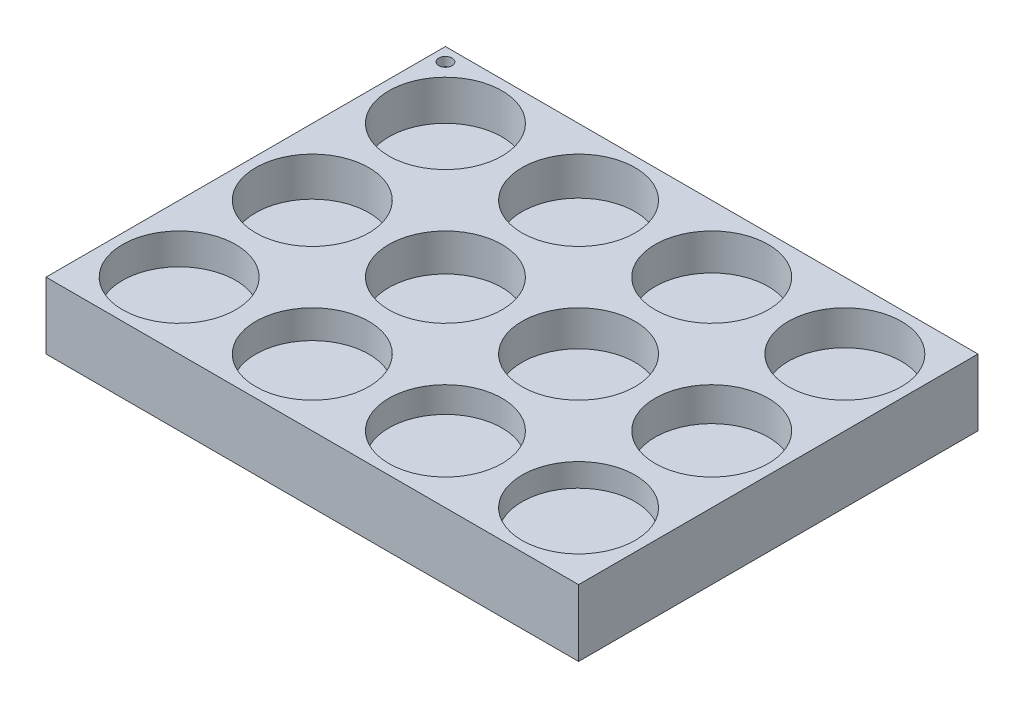
from build123d import *

# Parameters (mm, degrees)
SKETCH1_W           = 120
SKETCH1_H           = 90
SKETCH1_R           = 6.65
BOSS_EXTRUDE1_DEPTH = 5
SKETCH3_W           = 120
SKETCH3_H           = 90
BOSS_EXTRUDE6_DEPTH = 10
SKETCH2_R           = 12.75
CUT_EXTRUDE1_DEPTH  = 9
SKETCH2_8_R         = 12.75
CUT_EXTRUDE2_DEPTH  = 8.8
SKETCH2_9_R         = 12.75
CUT_EXTRUDE3_DEPTH  = 7
SKETCH2_10_R        = 12.75
CUT_EXTRUDE4_DEPTH  = 8.6
SKETCH2_11_R        = 12.75
CUT_EXTRUDE5_DEPTH  = 8.4
SKETCH2_12_R        = 12.75
CUT_EXTRUDE6_DEPTH  = 6.4
SKETCH2_13_R        = 12.75
CUT_EXTRUDE7_DEPTH  = 8.2
SKETCH2_14_R        = 12.75
CUT_EXTRUDE8_DEPTH  = 8
SKETCH2_15_R        = 12.75
CUT_EXTRUDE9_DEPTH  = 5.8
SKETCH2_16_R        = 12.75
CUT_EXTRUDE10_DEPTH = 7.8
SKETCH2_17_R        = 12.75
CUT_EXTRUDE11_DEPTH = 7.6
SKETCH2_18_R        = 12.75
CUT_EXTRUDE12_DEPTH = 5.2
SKETCH4_R           = 1.5
CUT_EXTRUDE13_DEPTH = 2


with BuildPart() as part:
    # Sketch1 → Boss-Extrude1 (new body)
    with BuildSketch(Plane(origin=(0, 0, 0), x_dir=(1, 0, 0), z_dir=(0, 1, 0))):
        Rectangle(SKETCH1_W, SKETCH1_H)
        with Locations(Location((-45, 30, 0), (0, 0, 270))):
            Circle(SKETCH1_R, mode=Mode.SUBTRACT)
        with Locations(Location((-15, 30, 0), (0, 0, 270))):
            Circle(SKETCH1_R, mode=Mode.SUBTRACT)
        with Locations(Location((15, 30, 0), (0, 0, 270))):
            Circle(SKETCH1_R, mode=Mode.SUBTRACT)
        with Locations(Location((45, 30, 0), (0, 0, 270))):
            Circle(SKETCH1_R, mode=Mode.SUBTRACT)
        with Locations(Location((-45, 0, 0), (0, 0, 270))):
            Circle(SKETCH1_R, mode=Mode.SUBTRACT)
        with Locations(Location((-15, 0, 0), (0, 0, 270))):
            Circle(SKETCH1_R, mode=Mode.SUBTRACT)
        with Locations(Location((15, 0, 0), (0, 0, 270))):
            Circle(SKETCH1_R, mode=Mode.SUBTRACT)
        with Locations(Location((45, 0, 0), (0, 0, 270))):
            Circle(SKETCH1_R, mode=Mode.SUBTRACT)
        with Locations(Location((-45, -30, 0), (0, 0, 270))):
            Circle(SKETCH1_R, mode=Mode.SUBTRACT)
        with Locations(Location((-15, -30, 0), (0, 0, 270))):
            Circle(SKETCH1_R, mode=Mode.SUBTRACT)
        with Locations(Location((15, -30, 0), (0, 0, 270))):
            Circle(SKETCH1_R, mode=Mode.SUBTRACT)
        with Locations(Location((45, -30, 0), (0, 0, 270))):
            Circle(SKETCH1_R, mode=Mode.SUBTRACT)
    extrude(amount=BOSS_EXTRUDE1_DEPTH)

    # Sketch3 → Boss-Extrude6 (add)
    with BuildSketch(Plane(origin=(0, 5, 0), x_dir=(1, 0, 0), z_dir=(0, 1, 0))):
        Rectangle(SKETCH3_W, SKETCH3_H)
    extrude(amount=BOSS_EXTRUDE6_DEPTH)

    # Sketch2 → Cut-Extrude1 (cut)
    with BuildSketch(Plane(origin=(0, 15, 0), x_dir=(1, 0, 0), z_dir=(0, 1, 0))):
        with Locations(Location((-45, 30, 0), (0, 0, 270))):
            Circle(SKETCH2_R)
    extrude(amount=-CUT_EXTRUDE1_DEPTH, mode=Mode.SUBTRACT)

    # Sketch2<8> → Cut-Extrude2 (cut)
    with BuildSketch(Plane(origin=(0, 15, 0), x_dir=(1, 0, 0), z_dir=(0, 1, 0))):
        with Locations(Location((-45, 0, 0), (0, 0, 270))):
            Circle(SKETCH2_8_R)
    extrude(amount=-CUT_EXTRUDE2_DEPTH, mode=Mode.SUBTRACT)

    # Sketch2<9> → Cut-Extrude3 (cut)
    with BuildSketch(Plane(origin=(0, 15, 0), x_dir=(1, 0, 0), z_dir=(0, 1, 0))):
        with Locations(Location((-45, -30, 0), (0, 0, 270))):
            Circle(SKETCH2_9_R)
    extrude(amount=-CUT_EXTRUDE3_DEPTH, mode=Mode.SUBTRACT)

    # Sketch2<10> → Cut-Extrude4 (cut)
    with BuildSketch(Plane(origin=(0, 15, 0), x_dir=(1, 0, 0), z_dir=(0, 1, 0))):
        with Locations(Location((-15, 30, 0), (0, 0, 270))):
            Circle(SKETCH2_10_R)
    extrude(amount=-CUT_EXTRUDE4_DEPTH, mode=Mode.SUBTRACT)

    # Sketch2<11> → Cut-Extrude5 (cut)
    with BuildSketch(Plane(origin=(0, 15, 0), x_dir=(1, 0, 0), z_dir=(0, 1, 0))):
        with Locations(Location((-15, 0, 0), (0, 0, 270))):
            Circle(SKETCH2_11_R)
    extrude(amount=-CUT_EXTRUDE5_DEPTH, mode=Mode.SUBTRACT)

    # Sketch2<12> → Cut-Extrude6 (cut)
    with BuildSketch(Plane(origin=(0, 15, 0), x_dir=(1, 0, 0), z_dir=(0, 1, 0))):
        with Locations(Location((-15, -30, 0), (0, 0, 270))):
            Circle(SKETCH2_12_R)
    extrude(amount=-CUT_EXTRUDE6_DEPTH, mode=Mode.SUBTRACT)

    # Sketch2<13> → Cut-Extrude7 (cut)
    with BuildSketch(Plane(origin=(0, 15, 0), x_dir=(1, 0, 0), z_dir=(0, 1, 0))):
        with Locations(Location((15, 30, 0), (0, 0, 270))):
            Circle(SKETCH2_13_R)
    extrude(amount=-CUT_EXTRUDE7_DEPTH, mode=Mode.SUBTRACT)

    # Sketch2<14> → Cut-Extrude8 (cut)
    with BuildSketch(Plane(origin=(0, 15, 0), x_dir=(1, 0, 0), z_dir=(0, 1, 0))):
        with Locations(Location((15, 0, 0), (0, 0, 270))):
            Circle(SKETCH2_14_R)
    extrude(amount=-CUT_EXTRUDE8_DEPTH, mode=Mode.SUBTRACT)

    # Sketch2<15> → Cut-Extrude9 (cut)
    with BuildSketch(Plane(origin=(0, 15, 0), x_dir=(1, 0, 0), z_dir=(0, 1, 0))):
        with Locations(Location((15, -30, 0), (0, 0, 270))):
            Circle(SKETCH2_15_R)
    extrude(amount=-CUT_EXTRUDE9_DEPTH, mode=Mode.SUBTRACT)

    # Sketch2<16> → Cut-Extrude10 (cut)
    with BuildSketch(Plane(origin=(0, 15, 0), x_dir=(1, 0, 0), z_dir=(0, 1, 0))):
        with Locations(Location((45, 30, 0), (0, 0, 270))):
            Circle(SKETCH2_16_R)
    extrude(amount=-CUT_EXTRUDE10_DEPTH, mode=Mode.SUBTRACT)

    # Sketch2<17> → Cut-Extrude11 (cut)
    with BuildSketch(Plane(origin=(0, 15, 0), x_dir=(1, 0, 0), z_dir=(0, 1, 0))):
        with Locations(Location((45, 0, 0), (0, 0, 270))):
            Circle(SKETCH2_17_R)
    extrude(amount=-CUT_EXTRUDE11_DEPTH, mode=Mode.SUBTRACT)

    # Sketch2<18> → Cut-Extrude12 (cut)
    with BuildSketch(Plane(origin=(0, 15, 0), x_dir=(1, 0, 0), z_dir=(0, 1, 0))):
        with Locations(Location((45, -30, 0), (0, 0, 270))):
            Circle(SKETCH2_18_R)
    extrude(amount=-CUT_EXTRUDE12_DEPTH, mode=Mode.SUBTRACT)

    # Sketch4 → Cut-Extrude13 (cut)
    with BuildSketch(Plane(origin=(0, 15, 0), x_dir=(1, 0, 0), z_dir=(0, 1, 0))):
        with Locations(Location((-57.00780573, 42.00780573, 0), (0, 0, 270))):
            Circle(SKETCH4_R)
    extrude(amount=-CUT_EXTRUDE13_DEPTH, mode=Mode.SUBTRACT)


solid = part.part
